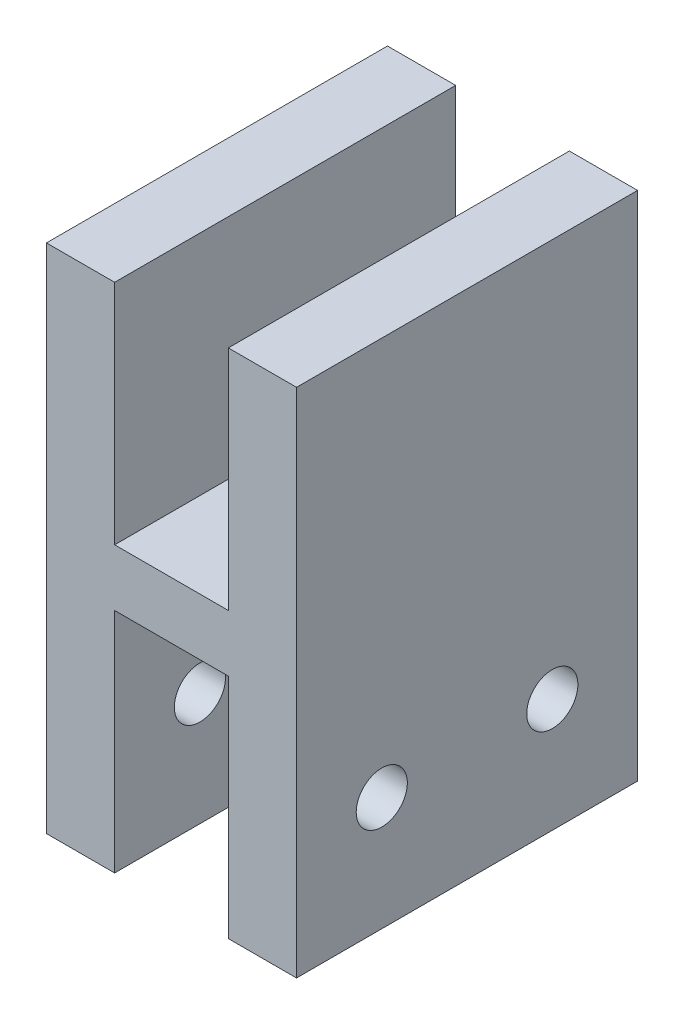
from build123d import *

# Parameters (mm, degrees)
ESTRUSIONE_ESTRUSIONE1_DEPTH = 30
FORO_PER_VITE_M4_1_D         = 4.5
FORO_PER_VITE_M4_1_DEPTH     = 30
FORO_PER_VITE_M4_1_TIP       = 1.351936393


with BuildPart() as part:
    # Schizzo1 → Estrusione-Estrusione1 (new body)
    with BuildSketch(Plane.XY):
        Polygon((11, -25), (11, 20), (5, 20), (5, 0), (-5, 0), (-5, 20), (-11, 20), (-11, -25), (-5, -25), (-5, -5), (5, -5), (5, -25), align=None)
    extrude(amount=ESTRUSIONE_ESTRUSIONE1_DEPTH)

    # Foro per Vite M4-1
    with Locations(Plane(origin=(-11, -15, 22.5), x_dir=(0, -1, 0), z_dir=(-1, 0, 0))):
        with Locations((0, 0), (0, -15)):
            Hole(FORO_PER_VITE_M4_1_D / 2, depth=FORO_PER_VITE_M4_1_DEPTH)
            with Locations((0, 0, -(FORO_PER_VITE_M4_1_DEPTH + FORO_PER_VITE_M4_1_TIP / 2))):  # 118° drill point
                Cone(0, FORO_PER_VITE_M4_1_D / 2, FORO_PER_VITE_M4_1_TIP, mode=Mode.SUBTRACT)


solid = part.part
